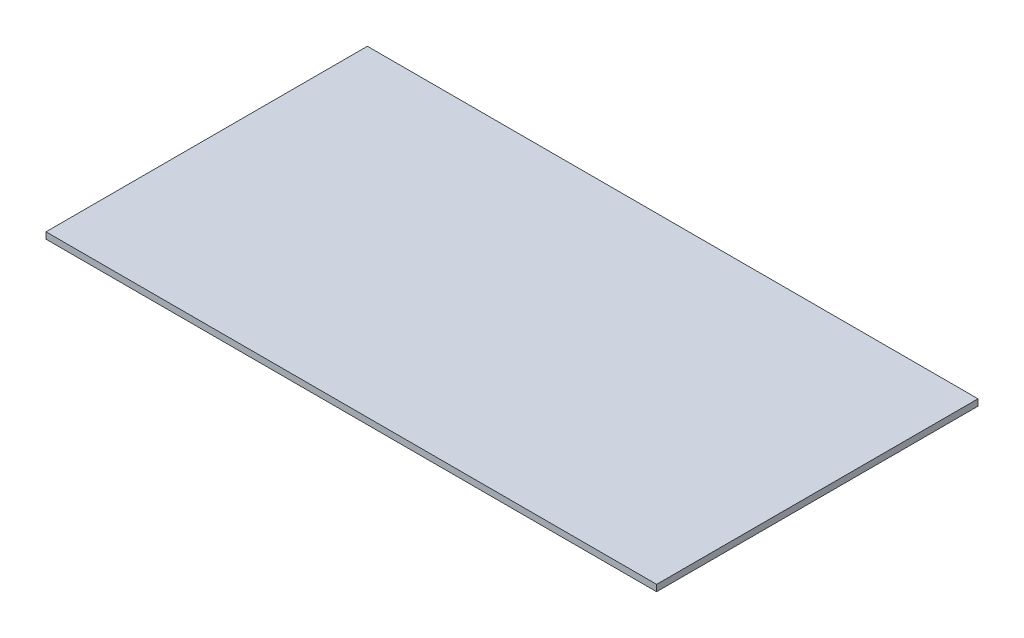
from build123d import *

# Parameters (mm, degrees)
SKETCH1_W           = 190
SKETCH1_H           = 100
BOSS_EXTRUDE1_DEPTH = 2


with BuildPart() as part:
    # Sketch1 → Boss-Extrude1 (new body)
    with BuildSketch(Plane(origin=(0, 0, 0), x_dir=(1, 0, 0), z_dir=(0, 1, 0))):
        with Locations((95, 50)):
            Rectangle(SKETCH1_W, SKETCH1_H)
    extrude(amount=BOSS_EXTRUDE1_DEPTH)


solid = part.part
